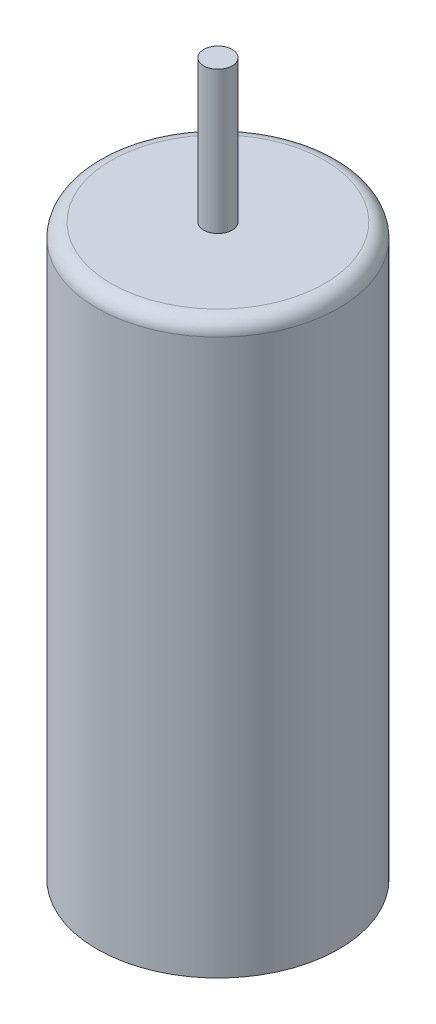
from build123d import *

# Parameters (mm, degrees)
CROQUIS1_R              = 4.25
SALIENTE_EXTRUIR1_DEPTH = 20
REDONDEO1_R             = 0.5
CROQUIS2_R              = 0.5
SALIENTE_EXTRUIR2_DEPTH = 5


with BuildPart() as part:
    # Croquis1 → Saliente-Extruir1 (new body)
    with BuildSketch(Plane(origin=(0, 0, 0), x_dir=(1, 0, 0), z_dir=(0, 1, 0))):
        with Locations(Location((0, 0, 0), (0, 0, 270))):
            Circle(CROQUIS1_R)
    extrude(amount=SALIENTE_EXTRUIR1_DEPTH)

    # Redondeo1
    redondeo1_edges = [part.edges().sort_by_distance(p)[0] for p in [
        (0, 20, -4.25),
    ]]
    fillet(redondeo1_edges, radius=REDONDEO1_R)

    # Croquis2 → Saliente-Extruir2 (add)
    with BuildSketch(Plane(origin=(0, 20, 0), x_dir=(1, 0, 0), z_dir=(0, 1, 0))):
        with Locations(Location((0, 0, 0), (0, 0, 270))):
            Circle(CROQUIS2_R)
    extrude(amount=SALIENTE_EXTRUIR2_DEPTH)


solid = part.part
